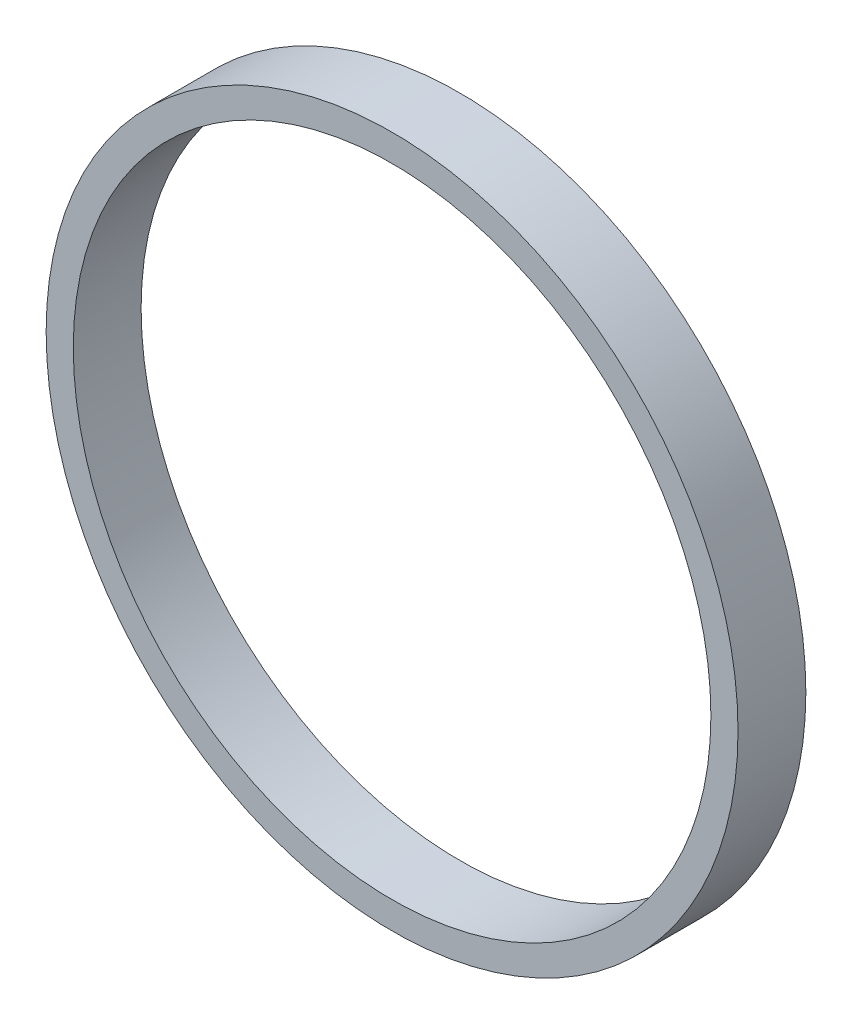
from build123d import *

# Parameters (mm, degrees)
EXTRUDE_START   = 267.5
SKETCH_1_R      = 51
SKETCH_1_R_2    = 47
EXTRUDE_1_DEPTH = 10


with BuildPart() as part:
    # 草圖1 → 填料-伸長1 (new body)
    with BuildSketch(Plane.XY.offset(EXTRUDE_START)):
        Circle(SKETCH_1_R)
        Circle(SKETCH_1_R_2, mode=Mode.SUBTRACT)
    extrude(amount=EXTRUDE_1_DEPTH)


solid = part.part
